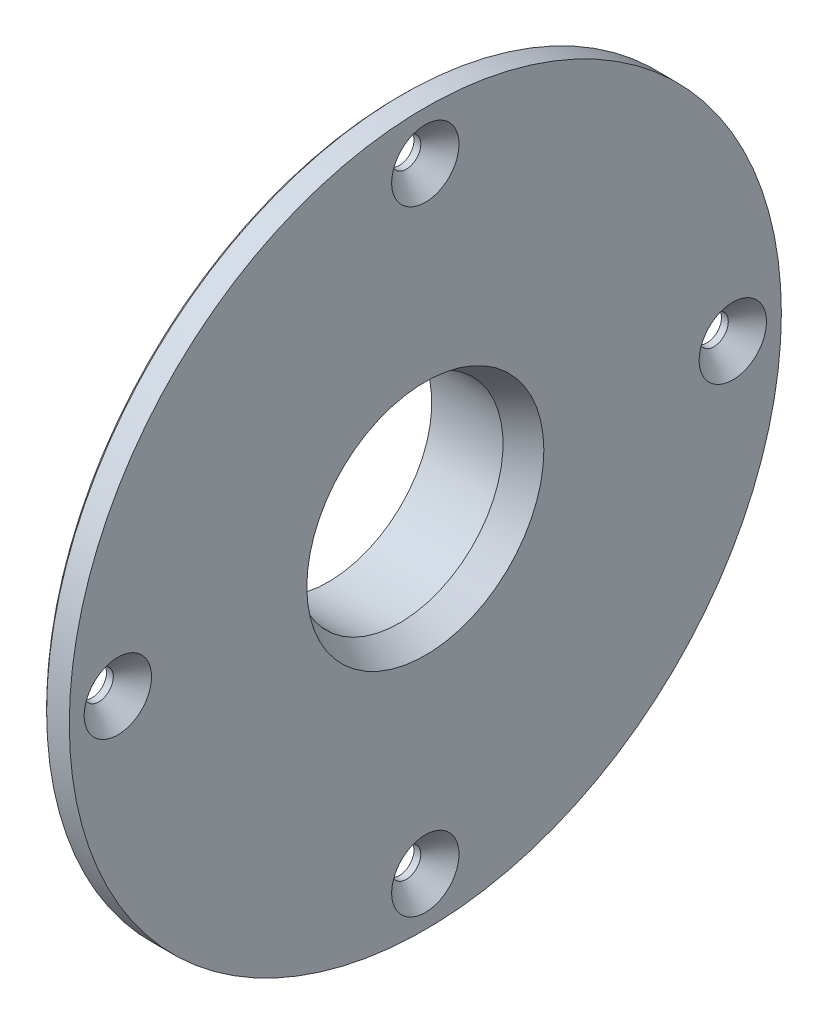
from build123d import *

# Parameters (mm, degrees)
FRAISAGE_POUR_VIS_T_TE_FRAIS_E_M42_D           = 4.5
FRAISAGE_POUR_VIS_T_TE_FRAIS_E_M42_CSINK_D     = 10.4
FRAISAGE_POUR_VIS_T_TE_FRAIS_E_M42_CSINK_ANGLE = 90
CHANFREIN1_SIZE                                = 0.5
TROU_TARAUD_M32_D                              = 2.5
TROU_TARAUD_M32_DEPTH                          = 10.5
TROU_TARAUD_M32_TIP                            = 0.751075774
CHANFREIN2_SIZE                                = 4
CHANFREIN2_SIZE2                               = 2.309401077


with BuildPart() as part:
    # Esquisse1 → Révolution1 (revolve)
    with BuildSketch(Plane.XY, mode=Mode.PRIVATE) as r_volution1_sk:
        Polygon((0, 16), (0, 25), (7, 25), (7, 26.5), (11, 26.5), (11, 55), (15, 55), (15, 16), align=None)
    revolve(r_volution1_sk.sketch.rotate(Axis((0, 0, 0), (1, 0, 0)), 90), axis=Axis((0, 0, 0), (1, 0, 0)))

    # Fraisage pour vis à tête fraisée M42 (through all)
    with Locations(Plane(origin=(15, 0, 0), x_dir=(0, 0, -1), z_dir=(1, 0, 0))):
        with Locations((0, 47.5), (47.5, 0), (0, -47.5), (-47.5, 0)):
            CounterSinkHole(FRAISAGE_POUR_VIS_T_TE_FRAIS_E_M42_D / 2, FRAISAGE_POUR_VIS_T_TE_FRAIS_E_M42_CSINK_D / 2, counter_sink_angle=FRAISAGE_POUR_VIS_T_TE_FRAIS_E_M42_CSINK_ANGLE)

    # Chanfrein1
    chanfrein1_edges = [part.edges().sort_by_distance(p)[0] for p in [
        (11, 0, -55),
        (0, 0, -25),
    ]]
    chamfer(chanfrein1_edges, length=CHANFREIN1_SIZE)

    # Trou taraudé M32
    with Locations(Plane.ZY):
        with Locations((0, 22.5), (-22.5, 0), (0, -22.5), (22.5, 0)):
            Hole(TROU_TARAUD_M32_D / 2, depth=TROU_TARAUD_M32_DEPTH)
            with Locations((0, 0, -(TROU_TARAUD_M32_DEPTH + TROU_TARAUD_M32_TIP / 2))):  # 118° drill point
                Cone(0, TROU_TARAUD_M32_D / 2, TROU_TARAUD_M32_TIP, mode=Mode.SUBTRACT)

    # Chanfrein2
    chanfrein2_edges = [part.edges().sort_by_distance(p)[0] for p in [
        (15, 0, -16),
    ]]
    chanfrein2_side = [part.faces().sort_by_distance(p)[0] for p in [
        (7.5, 0, -16),
    ]]
    chamfer(chanfrein2_edges, length=CHANFREIN2_SIZE, length2=CHANFREIN2_SIZE2, reference=chanfrein2_side[0])


solid = part.part
